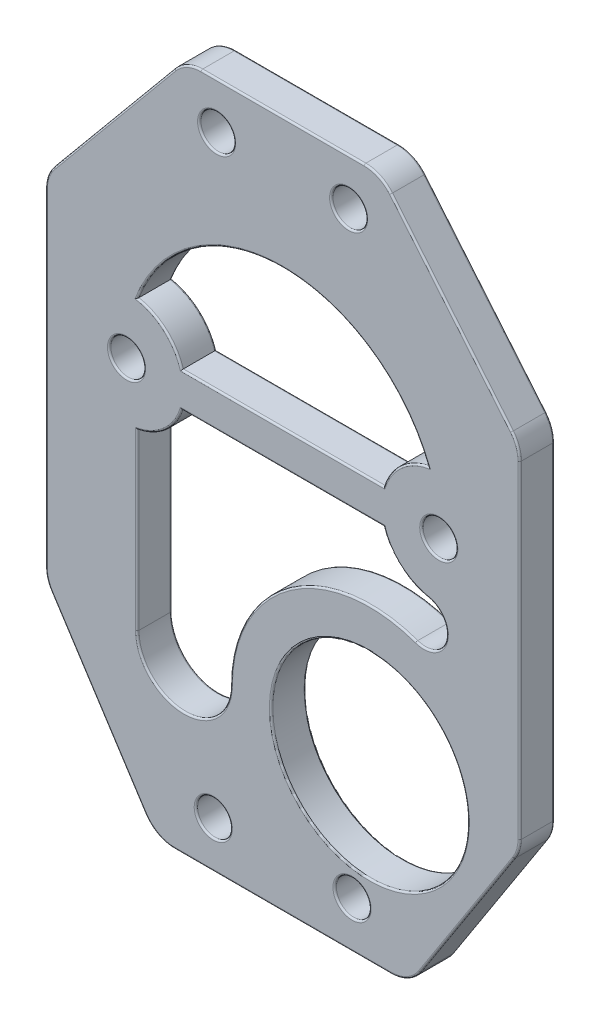
from build123d import *

# Parameters (mm, degrees)
SKETCH_1_R      = 1.5
SKETCH_1_R_2    = 8.5
EXTRUDE_1_DEPTH = 3
FILLET_1_R      = 3
FILLET_2_R      = 0.15
SCALE_1_SCALE   = 2.2


with BuildPart() as part:
    # Эскиз1 → Бобышка-Вытянуть1 (new body)
    with BuildSketch(Plane.XY):
        Polygon((11, 0), (-11, 0), (-20.5, 14.696938457), (-20.5, 44.996938457), (-8.459082017, 59.5), (8.459082017, 59.5), (20.5, 44.996938457), (20.5, 14.696938457), align=None)
        with Locations((-5.709082017, 55.5)):
            Circle(SKETCH_1_R, mode=Mode.SUBTRACT)
        with Locations((-13.5, 34.696938457)):
            Circle(SKETCH_1_R, mode=Mode.SUBTRACT)
        with Locations((-6, 4)):
            Circle(SKETCH_1_R, mode=Mode.SUBTRACT)
        with Locations(Location((6, 4, 0), (0, 0, 180))):
            Circle(SKETCH_1_R, mode=Mode.SUBTRACT)
        with Locations(Location((13.5, 34.696938457, 0), (0, 0, 180))):
            Circle(SKETCH_1_R, mode=Mode.SUBTRACT)
        with Locations(Location((5.709082017, 55.5, 0), (0, 0, 180))):
            Circle(SKETCH_1_R, mode=Mode.SUBTRACT)
        with Locations((7.5, 14.696938457)):
            Circle(SKETCH_1_R_2, mode=Mode.SUBTRACT)
        with BuildLine():
            Line((-8.730303993, 36.196938457), (8.730303993, 36.196938457))
            ThreePointArc((8.730303993, 36.196938457), (10.179901517, 38.435513862), (12.574074074, 39.610456665))
            ThreePointArc((12.574074074, 39.610456665), (0, 48.196938457), (-12.574074074, 39.610456665))
            ThreePointArc((-12.574074074, 39.610456665), (-10.179901517, 38.435513862), (-8.730303993, 36.196938457))
        make_face(mode=Mode.SUBTRACT)
        with BuildLine():
            Line((-8.730303993, 33.196938457), (8.730303993, 33.196938457))
            ThreePointArc((8.730303993, 33.196938457), (10.179901517, 30.958363052), (12.574074074, 29.783420249))
            ThreePointArc((12.574074074, 29.783420249), (14.109803486, 27.332458542), (11.545553196, 25.994438151))
            ThreePointArc((11.545553196, 25.994438151), (0.591550042, 24.508835275), (-4.5, 14.696938457))
            ThreePointArc((-4.5, 14.696938457), (-8.537037037, 10.65990142), (-12.574074074, 14.696938457))
            Line((-12.574074074, 14.696938457), (-12.574074074, 29.783420249))
            ThreePointArc((-12.574074074, 29.783420249), (-10.179901517, 30.958363052), (-8.730303993, 33.196938457))
        make_face(mode=Mode.SUBTRACT)
    extrude(amount=EXTRUDE_1_DEPTH)

    # Скругление1
    fillet_1_edges = [part.edges().sort_by_distance(p)[0] for p in [
        (-20.5, 14.696938457, 1.5),
        (-20.5, 44.996938457, 1.5),
        (-8.459082017, 59.5, 1.5),
        (8.459082017, 59.5, 1.5),
        (20.5, 44.996938457, 1.5),
        (20.5, 14.696938457, 1.5),
        (11, 0, 1.5),
        (-11, 0, 1.5),
    ]]
    fillet(fillet_1_edges, radius=FILLET_1_R)

    # Скругление2
    fillet_2_edges = [part.edges().sort_by_distance(p)[0] for p in [
        (0, 0, 0),
        (0, 0, 3),
        (10.801281169, 0.365069803, 0),
        (-10.801281169, 0.365069803, 0),
        (15.952978583, 7.662486465, 0),
        (-15.952978583, 7.662486465, 0),
        (20.377362116, 14.733123882, 0),
        (-20.377362116, 14.733123882, 0),
        (20.5, 29.748006309, 0),
        (-20.5, 29.748006309, 0),
        (20.321749339, 44.932587495, 0),
        (-20.321749339, 44.932587495, 0),
        (14.583481463, 52.123274886, 0),
        (-14.583481463, 52.123274886, 0),
        (8.325558832, 59.215601168, 0),
        (-8.325558832, 59.215601168, 0),
        (0, 59.5, 0),
        (-7.209082017, 55.5, 0),
        (-15, 34.696938457, 0),
        (-7.5, 4, 0),
        (7.5, 4, 0),
        (15, 34.696938457, 0),
        (7.209082017, 55.5, 0),
        (-1, 14.696938457, 0),
        (0, 48.196938457, 0),
        (-10.179901517, 38.435513862, 0),
        (0, 36.196938457, 0),
        (10.179901517, 38.435513862, 0),
        (0.591550042, 24.508835275, 0),
        (14.109803486, 27.332458542, 0),
        (10.179901517, 30.958363052, 0),
        (0, 33.196938457, 0),
        (-10.179901517, 30.958363052, 0),
        (-12.574074074, 22.240179353, 0),
        (-8.537037037, 10.65990142, 0),
        (10.801281169, 0.365069803, 3),
        (-10.801281169, 0.365069803, 3),
        (15.952978583, 7.662486465, 3),
        (-15.952978583, 7.662486465, 3),
        (20.377362116, 14.733123882, 3),
        (-20.377362116, 14.733123882, 3),
        (20.5, 29.748006309, 3),
        (-20.5, 29.748006309, 3),
        (20.321749339, 44.932587495, 3),
        (-20.321749339, 44.932587495, 3),
        (14.583481463, 52.123274886, 3),
        (-14.583481463, 52.123274886, 3),
        (8.325558832, 59.215601168, 3),
        (-8.325558832, 59.215601168, 3),
        (0, 59.5, 3),
        (-7.209082017, 55.5, 3),
        (-15, 34.696938457, 3),
        (-7.5, 4, 3),
        (7.5, 4, 3),
        (15, 34.696938457, 3),
        (7.209082017, 55.5, 3),
        (-1, 14.696938457, 3),
        (0, 48.196938457, 3),
        (-10.179901517, 38.435513862, 3),
        (0, 36.196938457, 3),
        (10.179901517, 38.435513862, 3),
        (0.591550042, 24.508835275, 3),
        (14.109803486, 27.332458542, 3),
        (10.179901517, 30.958363052, 3),
        (0, 33.196938457, 3),
        (-10.179901517, 30.958363052, 3),
        (-12.574074074, 22.240179353, 3),
        (-8.537037037, 10.65990142, 3),
    ]]
    fillet(fillet_2_edges, radius=FILLET_2_R)


with BuildPart() as part_1:
    # Масштаб1: scaled about (-0.515889001, 30.746354029, 1.5)
    add(part.part.scale(SCALE_1_SCALE).moved(Location((0.619066801, -36.895624835, -1.8))))


solid = part_1.part
